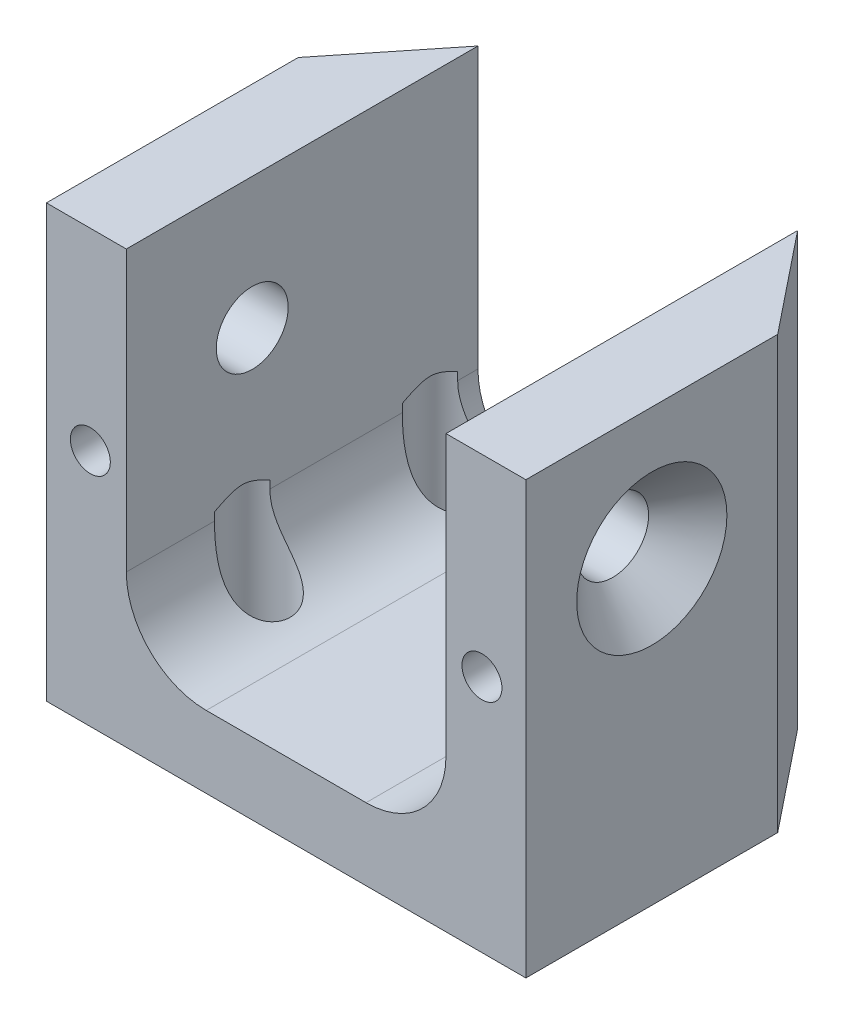
from build123d import *

# Parameters (mm, degrees)
BOSS_EXTRUDE1_DEPTH                                 = 27
SKETCH2_W                                           = 20
SKETCH2_H                                           = 22.5
CUT_EXTRUDE1_DEPTH                                  = 22
BOSS_EXTRUDE2_DEPTH                                 = 22
CSK_FOR_M4_COUNTERSUNK_FLAT_HEAD_SCREW1_D           = 4.5
CSK_FOR_M4_COUNTERSUNK_FLAT_HEAD_SCREW1_DEPTH       = 35
CSK_FOR_M4_COUNTERSUNK_FLAT_HEAD_SCREW1_CSINK_D     = 9.4
CSK_FOR_M4_COUNTERSUNK_FLAT_HEAD_SCREW1_CSINK_ANGLE = 90
CSK_FOR_M4_COUNTERSUNK_FLAT_HEAD_SCREW1_TIP         = 1.351936393
F_2_5MM_DOWEL_HOLE1_D                               = 2.5
F_2_5MM_DOWEL_HOLE1_DEPTH                           = 10
F_2_5MM_DOWEL_HOLE1_TIP                             = 0.751075774
F_4_0MM_DOWEL_HOLE1_D                               = 4
F_4_0MM_DOWEL_HOLE1_DEPTH                           = 10
F_4_0MM_DOWEL_HOLE1_TIP                             = 1.201721238


with BuildPart() as part:
    # Sketch1 → Boss-Extrude1 (new body)
    with BuildSketch(Plane(origin=(0, 0, 0), x_dir=(1, 0, 0), z_dir=(0, 1, 0))):
        Polygon((0, 0), (0, 15.755002002), (5, 22), (25, 22), (30, 15.755002002), (30, 0), align=None)
    extrude(amount=BOSS_EXTRUDE1_DEPTH)

    # Sketch2 → Cut-Extrude1 (cut)
    with BuildSketch(Plane.XY):
        with Locations((15, 15.75)):
            Rectangle(SKETCH2_W, SKETCH2_H)
    extrude(amount=-CUT_EXTRUDE1_DEPTH, mode=Mode.SUBTRACT)

    # Sketch3 → Boss-Extrude2 (add)
    with BuildSketch(Plane.XY):
        with BuildLine():
            Line((5, 9.5), (5, 4.5))
            Line((5, 4.5), (10, 4.5))
            ThreePointArc((10, 4.5), (6.464466094, 5.964466094), (5, 9.5))
        make_face()
        with BuildLine():
            Line((25, 9.5), (25, 4.5))
            Line((25, 4.5), (20, 4.5))
            ThreePointArc((20, 4.5), (23.535533906, 5.964466094), (25, 9.5))
        make_face()
    extrude(amount=-BOSS_EXTRUDE2_DEPTH)

    # CSK for M4 Countersunk Flat Head Screw1
    with Locations(Plane(origin=(30, 0, 0), x_dir=(0, 0, -1), z_dir=(1, 0, 0))):
        with Locations((7.877501001, 18.78691821)):
            CounterSinkHole(CSK_FOR_M4_COUNTERSUNK_FLAT_HEAD_SCREW1_D / 2, CSK_FOR_M4_COUNTERSUNK_FLAT_HEAD_SCREW1_CSINK_D / 2, depth=CSK_FOR_M4_COUNTERSUNK_FLAT_HEAD_SCREW1_DEPTH, counter_sink_angle=CSK_FOR_M4_COUNTERSUNK_FLAT_HEAD_SCREW1_CSINK_ANGLE)
            with Locations((0, 0, -(CSK_FOR_M4_COUNTERSUNK_FLAT_HEAD_SCREW1_DEPTH + CSK_FOR_M4_COUNTERSUNK_FLAT_HEAD_SCREW1_TIP / 2))):  # 118° drill point
                Cone(0, CSK_FOR_M4_COUNTERSUNK_FLAT_HEAD_SCREW1_D / 2, CSK_FOR_M4_COUNTERSUNK_FLAT_HEAD_SCREW1_TIP, mode=Mode.SUBTRACT)

    # Ø2.5mm Dowel Hole1
    with Locations(Plane.XY):
        with Locations((2.75, 14.95), (27.25, 14.95)):
            Hole(F_2_5MM_DOWEL_HOLE1_D / 2, depth=F_2_5MM_DOWEL_HOLE1_DEPTH)
            with Locations((0, 0, -(F_2_5MM_DOWEL_HOLE1_DEPTH + F_2_5MM_DOWEL_HOLE1_TIP / 2))):  # 118° drill point
                Cone(0, F_2_5MM_DOWEL_HOLE1_D / 2, F_2_5MM_DOWEL_HOLE1_TIP, mode=Mode.SUBTRACT)

    # Ø4.0mm Dowel Hole1
    with Locations(Plane(origin=(0, 0, 0), x_dir=(-1, 0, 0), z_dir=(0, -1, 0))):
        with Locations((-24, 19), (-6, 19), (-6, 7.25), (-24, 7.25)):
            Hole(F_4_0MM_DOWEL_HOLE1_D / 2, depth=F_4_0MM_DOWEL_HOLE1_DEPTH)
            with Locations((0, 0, -(F_4_0MM_DOWEL_HOLE1_DEPTH + F_4_0MM_DOWEL_HOLE1_TIP / 2))):  # 118° drill point
                Cone(0, F_4_0MM_DOWEL_HOLE1_D / 2, F_4_0MM_DOWEL_HOLE1_TIP, mode=Mode.SUBTRACT)


solid = part.part
